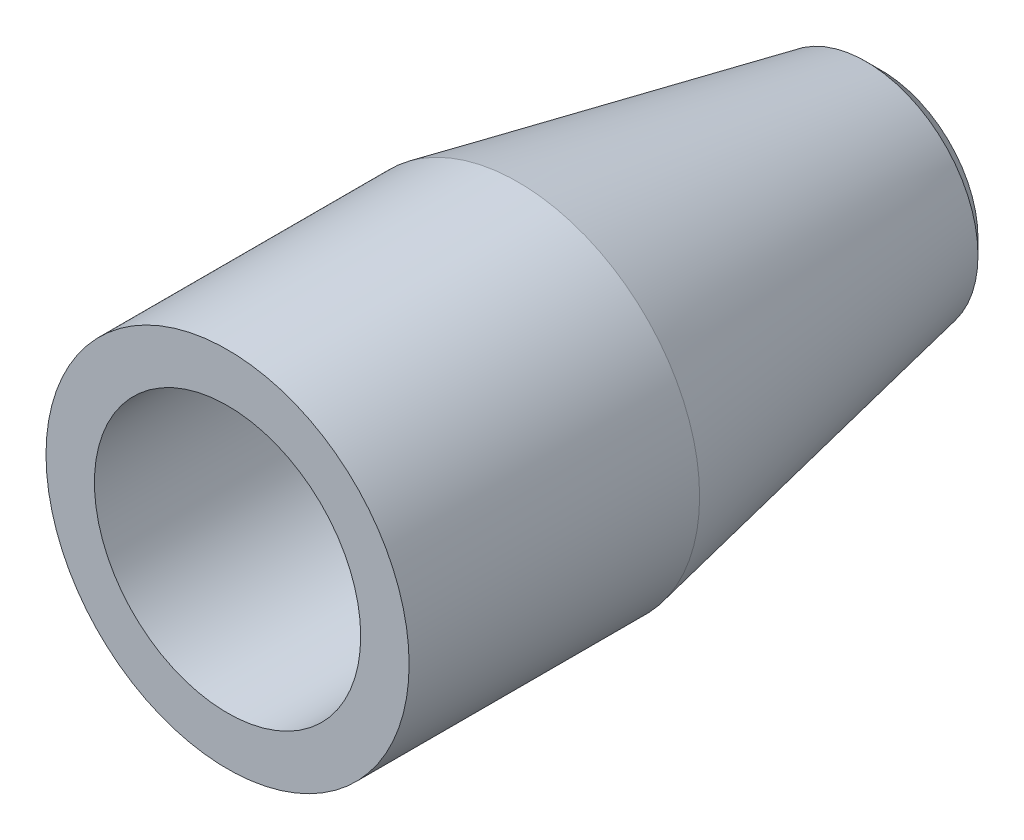
from build123d import *

# Parameters (mm, degrees)
CHAMFER1_SIZE  = 0.5
CHAMFER1_SIZE2 = 0.637377439


with BuildPart() as part:
    # Sketch1 → Revolve1 (revolve)
    with BuildSketch(Plane(origin=(0, 0, 0), x_dir=(1, 0, 0), z_dir=(0, 1, 0))):
        Polygon((2, 9.237606838), (2, 7.237606838), (2.9, 7.237606838), (5.5, -5.762393162), (5.5, -17.762393162), (7.5, -17.762393162), (7.5, -5.762393162), (4.5, 9.237606838), align=None)
    revolve(axis=Axis((0, 0, 0), (0, 0, -1)))

    # Chamfer1
    chamfer1_edges = [part.edges().sort_by_distance(p)[0] for p in [
        (-4.5, 0, -9.237606838),
    ]]
    chamfer1_side = [part.faces().sort_by_distance(p)[0] for p in [
        (-4.372720779, 0, -9.237606838),
    ]]
    chamfer(chamfer1_edges, length=CHAMFER1_SIZE, length2=CHAMFER1_SIZE2, reference=chamfer1_side[0])


solid = part.part
